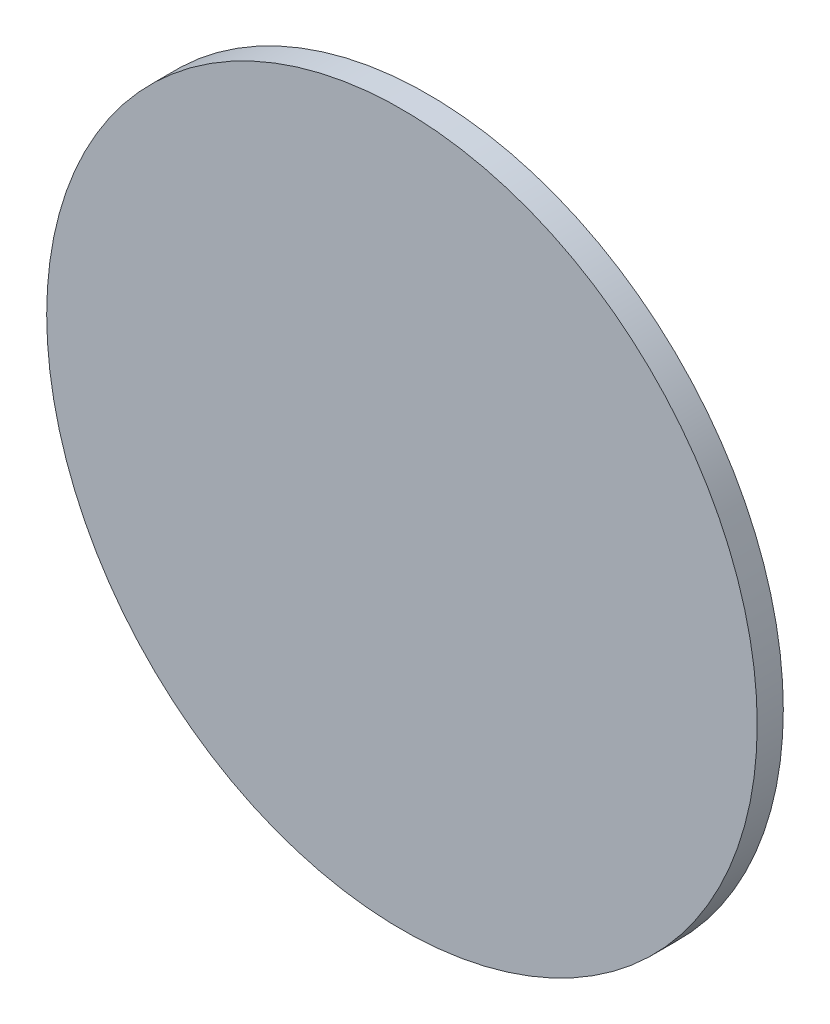
from build123d import *

# Parameters (mm, degrees)
SKETCH1_R           = 27.233199204
BOSS_EXTRUDE1_DEPTH = 2


with BuildPart() as part:
    # Sketch1 → Boss-Extrude1 (new body)
    with BuildSketch(Plane.XY):
        with Locations((-114.963536702, 311.588392387)):
            Circle(SKETCH1_R)
    extrude(amount=BOSS_EXTRUDE1_DEPTH)


solid = part.part
